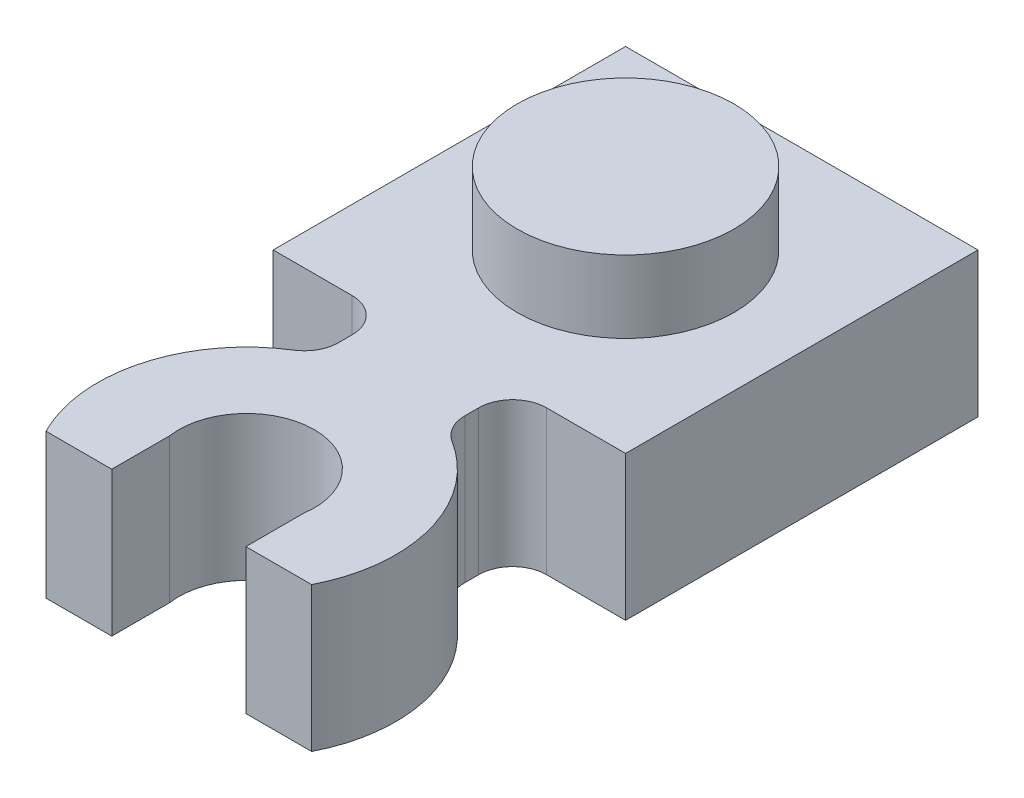
from build123d import *

# Parameters (mm, degrees)
SKETCH1_W           = 7.8
SKETCH1_H           = 3.2
BOSS_EXTRUDE1_DEPTH = 7.8
SKETCH2_R           = 2.4
BOSS_EXTRUDE2_DEPTH = 1.6
SHELL1_T            = -0.7
SKETCH3_W           = 2.8
SKETCH3_H           = 3.2
BOSS_EXTRUDE3_DEPTH = 1.5
BOSS_EXTRUDE4_DEPTH = 3.2
FILLET1_R           = 0.75
FILLET2_R           = 0.75
SKETCH6_R           = 0.424931422
CUT_EXTRUDE1_DEPTH  = 1.6


with BuildPart() as part:
    # Sketch1 → Boss-Extrude1 (new body)
    with BuildSketch(Plane.XY):
        with Locations((3.9, 1.6)):
            Rectangle(SKETCH1_W, SKETCH1_H)
    extrude(amount=-BOSS_EXTRUDE1_DEPTH)

    # Sketch2 → Boss-Extrude2 (add)
    with BuildSketch(Plane(origin=(0, 3.2, 0), x_dir=(1, 0, 0), z_dir=(0, 1, 0))):
        with Locations(Location((3.9, 3.9, 0), (0, 0, 270))):
            Circle(SKETCH2_R)
    extrude(amount=BOSS_EXTRUDE2_DEPTH)

    # Shell1
    shell1_openings = [part.faces().sort_by_distance(p)[0] for p in [
        (3.9, 0, -3.9),
    ]]
    offset(amount=SHELL1_T, openings=shell1_openings, kind=Kind.INTERSECTION)

    # Sketch3 → Boss-Extrude3 (add)
    with BuildSketch(Plane.XY):
        with Locations((3.9, 1.6)):
            Rectangle(SKETCH3_W, SKETCH3_H)
    extrude(amount=BOSS_EXTRUDE3_DEPTH)

    # Sketch5 → Boss-Extrude4 (add)
    with BuildSketch(Plane(origin=(0, 3.2, 0), x_dir=(1, 0, 0), z_dir=(0, 1, 0))):
        with BuildLine():
            Line((0.960612309, -5.988310559), (2.416065979, -5.988310559))
            Line((2.416065979, -5.988310559), (2.416065979, -4.707262204))
            ThreePointArc((2.416065979, -4.707262204), (3.9, -2.988310559), (5.383934021, -4.707262204))
            Line((5.383934021, -4.707262204), (5.383934021, -5.988310559))
            Line((5.383934021, -5.988310559), (6.839387691, -5.988310559))
            ThreePointArc((6.839387691, -5.988310559), (3.9, -1.188310559), (0.960612309, -5.988310559))
        make_face()
    extrude(amount=-BOSS_EXTRUDE4_DEPTH)

    # Fillet1
    fillet1_edges = [part.edges().sort_by_distance(p)[0] for p in [
        (2.5, 1.6, 0),
        (2.5, 1.6, 1.5),
    ]]
    fillet(fillet1_edges, radius=FILLET1_R)

    # Fillet2
    fillet2_edges = [part.edges().sort_by_distance(p)[0] for p in [
        (5.3, 1.6, 0),
        (5.3, 1.6, 1.5),
    ]]
    fillet(fillet2_edges, radius=FILLET2_R)

    # Sketch6 → Cut-Extrude1 (cut)
    with BuildSketch(Plane.XZ):
        with Locations(Location((3.7900748, 0.342701654, 0), (0, 0, 270))):
            Circle(SKETCH6_R)
    extrude(amount=-CUT_EXTRUDE1_DEPTH, mode=Mode.SUBTRACT)


solid = part.part
